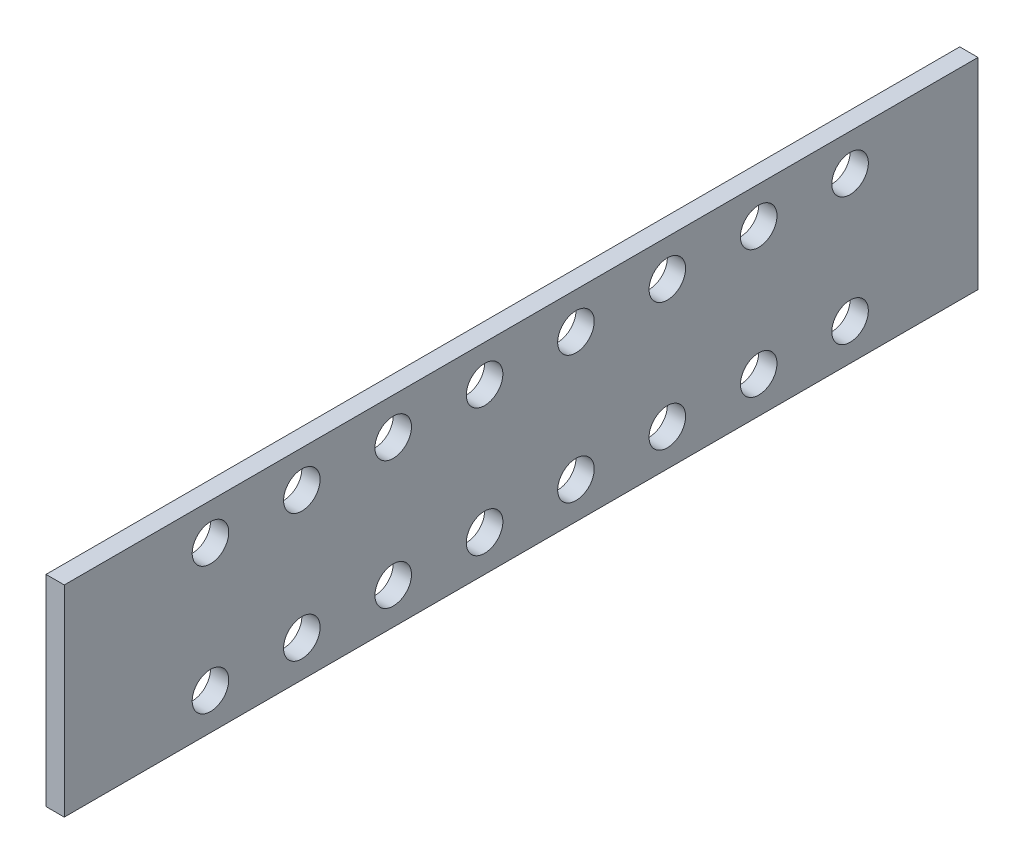
from build123d import *

# Parameters (mm, degrees)
SKETCH2_W               = 500
SKETCH2_H               = 150
BOSS_EXTRUDE1_DEPTH     = 10
SKETCH3_R               = 10
CUT_EXTRUDE1_DEPTH      = 10
LPATTERN1_COUNT         = 8
LPATTERN1_PITCH         = 50
MIRROR1_COPY_1_SKETCH_R = 10
MIRROR1_COPY_1_DEPTH    = 10
MIRROR1_COPY_2_SKETCH_R = 10
MIRROR1_COPY_2_DEPTH    = 10
MIRROR1_COPY_3_SKETCH_R = 10
MIRROR1_COPY_3_DEPTH    = 10
MIRROR1_COPY_4_SKETCH_R = 10
MIRROR1_COPY_4_DEPTH    = 10
MIRROR1_COPY_5_SKETCH_R = 10
MIRROR1_COPY_5_DEPTH    = 10
MIRROR1_COPY_6_SKETCH_R = 10
MIRROR1_COPY_6_DEPTH    = 10
MIRROR1_COPY_7_SKETCH_R = 10
MIRROR1_COPY_7_DEPTH    = 10
SKETCH4_W               = 500
SKETCH4_H               = 19.989679831
SKETCH4_H_2             = 19.964210349
CUT_EXTRUDE2_DEPTH      = 10


with BuildPart() as part:
    # Sketch2 → Boss-Extrude1 (new body)
    with BuildSketch(Plane(origin=(0, 0, 0), x_dir=(0, 0, -1), z_dir=(1, 0, 0))):
        with Locations((250, 75)):
            Rectangle(SKETCH2_W, SKETCH2_H)
    extrude(amount=BOSS_EXTRUDE1_DEPTH)

    # Sketch3 → Cut-Extrude1 (cut)
    with BuildSketch(Plane(origin=(10, 0, 0), x_dir=(0, 0, -1), z_dir=(1, 0, 0))):
        with Locations((80, 110)):
            Circle(SKETCH3_R)
    cut_extrude1 = extrude(amount=-CUT_EXTRUDE1_DEPTH, mode=Mode.SUBTRACT)

    # LPattern1: Cut-Extrude1 ×8
    with Locations(*[(0, 0, -i * LPATTERN1_PITCH) for i in range(1, LPATTERN1_COUNT)]):
        add(cut_extrude1, mode=Mode.SUBTRACT)

    # Mirror1: Cut-Extrude1 across plane
    add(cut_extrude1.mirror(Plane.ZX.offset(75)), mode=Mode.SUBTRACT)

    # Mirror1 copy 1 sketch → Mirror1 copy 1 (cut)
    with BuildSketch(Plane(origin=(10, 150, -50), x_dir=(0, 0, -1), z_dir=(1, 0, 0))):
        with Locations((80, -110)):
            Circle(MIRROR1_COPY_1_SKETCH_R)
    extrude(amount=-MIRROR1_COPY_1_DEPTH, mode=Mode.SUBTRACT)

    # Mirror1 copy 2 sketch → Mirror1 copy 2 (cut)
    with BuildSketch(Plane(origin=(10, 150, -100), x_dir=(0, 0, -1), z_dir=(1, 0, 0))):
        with Locations((80, -110)):
            Circle(MIRROR1_COPY_2_SKETCH_R)
    extrude(amount=-MIRROR1_COPY_2_DEPTH, mode=Mode.SUBTRACT)

    # Mirror1 copy 3 sketch → Mirror1 copy 3 (cut)
    with BuildSketch(Plane(origin=(10, 150, -150), x_dir=(0, 0, -1), z_dir=(1, 0, 0))):
        with Locations((80, -110)):
            Circle(MIRROR1_COPY_3_SKETCH_R)
    extrude(amount=-MIRROR1_COPY_3_DEPTH, mode=Mode.SUBTRACT)

    # Mirror1 copy 4 sketch → Mirror1 copy 4 (cut)
    with BuildSketch(Plane(origin=(10, 150, -200), x_dir=(0, 0, -1), z_dir=(1, 0, 0))):
        with Locations((80, -110)):
            Circle(MIRROR1_COPY_4_SKETCH_R)
    extrude(amount=-MIRROR1_COPY_4_DEPTH, mode=Mode.SUBTRACT)

    # Mirror1 copy 5 sketch → Mirror1 copy 5 (cut)
    with BuildSketch(Plane(origin=(10, 150, -250), x_dir=(0, 0, -1), z_dir=(1, 0, 0))):
        with Locations((80, -110)):
            Circle(MIRROR1_COPY_5_SKETCH_R)
    extrude(amount=-MIRROR1_COPY_5_DEPTH, mode=Mode.SUBTRACT)

    # Mirror1 copy 6 sketch → Mirror1 copy 6 (cut)
    with BuildSketch(Plane(origin=(10, 150, -300), x_dir=(0, 0, -1), z_dir=(1, 0, 0))):
        with Locations((80, -110)):
            Circle(MIRROR1_COPY_6_SKETCH_R)
    extrude(amount=-MIRROR1_COPY_6_DEPTH, mode=Mode.SUBTRACT)

    # Mirror1 copy 7 sketch → Mirror1 copy 7 (cut)
    with BuildSketch(Plane(origin=(10, 150, -350), x_dir=(0, 0, -1), z_dir=(1, 0, 0))):
        with Locations((80, -110)):
            Circle(MIRROR1_COPY_7_SKETCH_R)
    extrude(amount=-MIRROR1_COPY_7_DEPTH, mode=Mode.SUBTRACT)

    # Sketch4 → Cut-Extrude2 (cut)
    with BuildSketch(Plane.ZY):
        with Locations((-250, 140.005160085)):
            Rectangle(SKETCH4_W, SKETCH4_H)
        with Locations((-250, 9.982105175)):
            Rectangle(SKETCH4_W, SKETCH4_H_2)
    extrude(amount=-CUT_EXTRUDE2_DEPTH, mode=Mode.SUBTRACT)


solid = part.part
